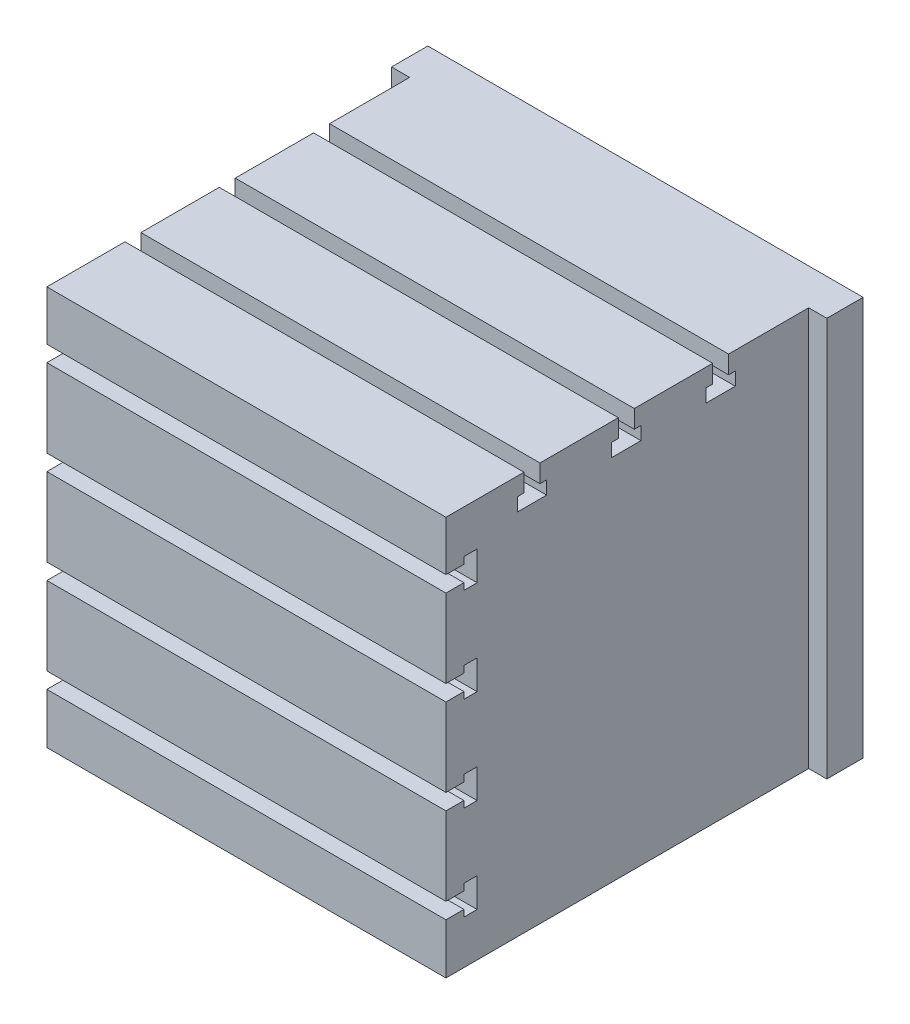
from build123d import *

# Parameters (mm, degrees)
BOSS_EXTRUDE1_DEPTH = 550
CUT_EXTRUDE1_REACH  = 969.277
CUT_EXTRUDE2_REACH  = 969.277
LPATTERN1_COUNT     = 3
LPATTERN1_PITCH     = 130
LPATTERN2_COUNT     = 4
LPATTERN2_PITCH     = 130


with BuildPart() as part:
    # Sketch1 → Boss-Extrude1 (new body)
    with BuildSketch(Plane(origin=(0, 0, 0), x_dir=(1, 0, 0), z_dir=(0, 1, 0))):
        Polygon((300, 0), (-300, 0), (-300, -50), (-275, -50), (-275, -550), (275, -550), (275, -50), (300, -50), align=None)
    extrude(amount=-BOSS_EXTRUDE1_DEPTH)

    # Sketch2 → Cut-Extrude1 (cut, up to next)
    with BuildSketch(Plane.ZY.offset(275), mode=Mode.PRIVATE) as cut_extrude1_sk1:
        Polygon((442.4, 0), (442.4, -24.8), (451.6, -24.8), (451.6, -43), (411.2, -43), (411.2, -24.8), (420.4, -24.8), (420.4, 0), align=None)
    cut_extrude1_tool1 = extrude(cut_extrude1_sk1.sketch, amount=-CUT_EXTRUDE1_REACH, mode=Mode.PRIVATE) & part.part
    cut_extrude1 = cut_extrude1_tool1.solids().sort_by_distance((-275, -24.741921, 431.4))[0]
    add(cut_extrude1, mode=Mode.SUBTRACT)

    # Sketch3 → Cut-Extrude2 (cut, up to next)
    with BuildSketch(Plane.ZY.offset(275), mode=Mode.PRIVATE) as cut_extrude2_sk1:
        Polygon((550, -90.5), (550, -68.5), (525.2, -68.5), (525.2, -59.3), (507, -59.3), (507, -99.7), (525.2, -99.7), (525.2, -90.5), align=None)
    cut_extrude2_tool1 = extrude(cut_extrude2_sk1.sketch, amount=-CUT_EXTRUDE2_REACH, mode=Mode.PRIVATE) & part.part
    cut_extrude2 = cut_extrude2_tool1.solids().sort_by_distance((-275, -79.5, 525.258079))[0]
    add(cut_extrude2, mode=Mode.SUBTRACT)

    # LPattern1: Cut-Extrude1 ×3
    with Locations(*[(0, 0, -i * LPATTERN1_PITCH) for i in range(1, LPATTERN1_COUNT)]):
        add(cut_extrude1, mode=Mode.SUBTRACT)

    # LPattern2: Cut-Extrude2 ×4
    with Locations(*[(0, -i * LPATTERN2_PITCH, 0) for i in range(1, LPATTERN2_COUNT)]):
        add(cut_extrude2, mode=Mode.SUBTRACT)


solid = part.part
